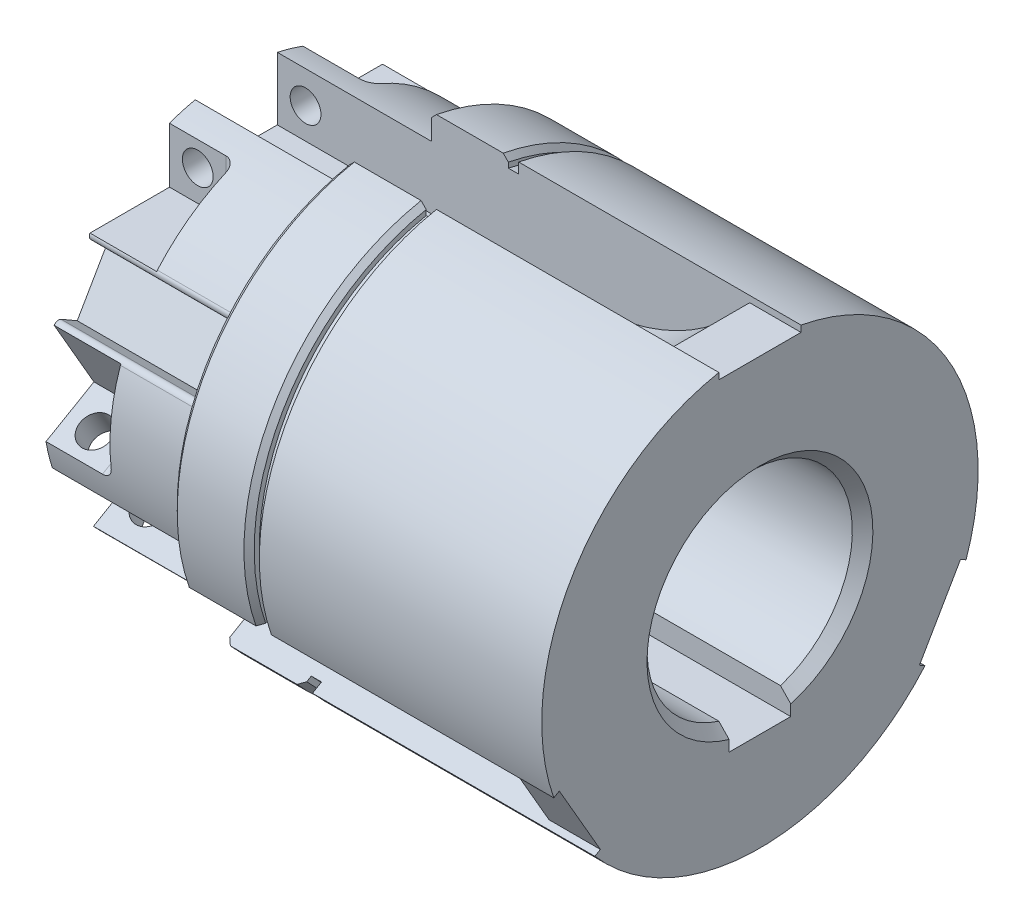
from build123d import *

# Parameters (mm, degrees)
CUT_EXTRUDE1_DEPTH       = 8
CIRPATTERN1_COUNT        = 3
CUT_EXTRUDE2_DEPTH       = 13
FILLET1_R                = 2
CUT_EXTRUDE3_REACH       = 125.655
SKETCH6_R                = 3
CIRPATTERN2_COUNT        = 3
FILLET1_OF_CIRPATTERN2_R = 2
CUT_EXTRUDE4_DEPTH       = 30
FILLET2_R                = 1
CIRPATTERN3_COUNT        = 3
FILLET2_OF_CIRPATTERN3_R = 1
CUT_EXTRUDE5_REACH       = 130.22
SKETCH9_W                = 102
SKETCH9_H                = 12
CHAMFER2_SIZE            = 2
CHAMFER3_SIZE            = 1


with BuildPart() as part:
    # Sketch1 → Revolve1 (revolve)
    with BuildSketch(Plane.XY, mode=Mode.PRIVATE) as revolve1_sk:
        Polygon((0, 20), (0, 42.5), (-55, 42.5), (-55, 40.5), (-57, 40.5), (-57, 42.5), (-72, 42.5), (-72, 37.6), (-102, 37.6), (-102, 20), align=None)
    revolve(revolve1_sk.sketch.rotate(Axis((-534.701035213, 0, 0), (1, 0, 0)), 90), axis=Axis((-534.701035213, 0, 0), (1, 0, 0)))

    # Sketch3 → Cut-Extrude1 (cut, symmetric)
    with BuildSketch(Plane.XY):
        with BuildLine():
            Line((-102, 24.5), (-42, 24.5))
            ThreePointArc((-42, 24.5), (-24.11145618, 28.72291236), (-10, 40.5))
            Line((-10, 40.5), (0, 40.5))
            Line((0, 40.5), (0, 42.5))
            Line((0, 42.5), (-55, 42.5))
            Line((-55, 42.5), (-55, 40.5))
            Line((-55, 40.5), (-57, 40.5))
            Line((-57, 40.5), (-57, 42.5))
            Line((-57, 42.5), (-72, 42.5))
            Line((-72, 42.5), (-72, 37.6))
            Line((-72, 37.6), (-102, 37.6))
            Line((-102, 37.6), (-102, 24.5))
        make_face()
    cut_extrude1 = extrude(amount=CUT_EXTRUDE1_DEPTH, both=True, mode=Mode.SUBTRACT)

    # CirPattern1: Cut-Extrude1 ×3 about axis
    cirpattern1_axis = Axis((0, 0, 0), (1, 0, 0))
    for i in range(1, CIRPATTERN1_COUNT):
        add(cut_extrude1.rotate(cirpattern1_axis, i * 360 / CIRPATTERN1_COUNT), mode=Mode.SUBTRACT)

    # Sketch4 → Cut-Extrude2 (cut)
    with BuildSketch(Plane.ZY.offset(102)):
        with BuildLine():
            Line((-13, 35.281156444), (-13, 24.5))
            Line((-13, 24.5), (-28.522096697, 24.5))
            ThreePointArc((-28.522096697, 24.5), (-21.449462979, 30.881718506), (-13, 35.281156444))
        make_face()
        with BuildLine():
            Line((13, 35.281156444), (13, 24.5))
            Line((13, 24.5), (28.522096697, 24.5))
            ThreePointArc((28.522096697, 24.5), (21.449462979, 30.881718506), (13, 35.281156444))
        make_face()
    cut_extrude2 = extrude(amount=-CUT_EXTRUDE2_DEPTH, mode=Mode.SUBTRACT)

    # Fillet1
    fillet1_edges = [part.edges().sort_by_distance(p)[0] for p in [
        (-89, 29.890578222, -13),
        (-89, 29.890578222, 13),
    ]]
    fillet(fillet1_edges, radius=FILLET1_R)

    # Cut-Extrude3: up to this face of the body (flat: up to its plane)
    cut_extrude3_end = Plane(part.part.faces().sort_by_distance((-96.5, 29.890578222, -13))[0])
    # Sketch6 → Cut-Extrude3 (cut, up to the picked face)
    with BuildSketch(Plane.XY.offset(13), mode=Mode.PRIVATE) as cut_extrude3_sk1:
        with Locations((-96.5, 30.5)):
            Circle(SKETCH6_R)
    cut_extrude3_tool1 = split(extrude(cut_extrude3_sk1.sketch, amount=-CUT_EXTRUDE3_REACH, mode=Mode.PRIVATE), bisect_by=cut_extrude3_end, keep=Keep.BOTH, mode=Mode.PRIVATE)
    cut_extrude3 = cut_extrude3_tool1.solids().sort_by(Axis((-96.5, 30.5, 13), (0, 0, -1)))[0]
    add(cut_extrude3, mode=Mode.SUBTRACT)

    # CirPattern2: Cut-Extrude2, Cut-Extrude3 ×3 about axis
    cirpattern2_axis = Axis((0, 0, 0), (1, 0, 0))
    add([cut_extrude2.rotate(cirpattern2_axis, i * 360 / CIRPATTERN2_COUNT) for i in range(1, CIRPATTERN2_COUNT)], mode=Mode.SUBTRACT)
    add([cut_extrude3.rotate(cirpattern2_axis, i * 360 / CIRPATTERN2_COUNT) for i in range(1, CIRPATTERN2_COUNT)], mode=Mode.SUBTRACT)

    # Fillet1 of CirPattern2
    fillet1_of_cirpattern2_edges = [part.edges().sort_by_distance(p)[0] for p in [
        (-89, -3.686958862, 32.386000074),
        (-89, -26.20361936, 19.386000074),
        (-89, -26.20361936, -19.386000074),
        (-89, -3.686958862, -32.386000074),
    ]]
    fillet(fillet1_of_cirpattern2_edges, radius=FILLET1_OF_CIRPATTERN2_R)

    # Sketch7 → Cut-Extrude4 (cut)
    with BuildSketch(Plane.ZY.offset(102)):
        with BuildLine():
            Line((-6, -37.118189611), (-6, -32.3))
            Line((-6, -32.3), (6, -32.3))
            Line((6, -32.3), (6, -37.118189611))
            ThreePointArc((6, -37.118189611), (0, -37.6), (-6, -37.118189611))
        make_face()
    cut_extrude4 = extrude(amount=-CUT_EXTRUDE4_DEPTH, mode=Mode.SUBTRACT)

    # Fillet2
    fillet2_edges = [part.edges().sort_by_distance(p)[0] for p in [
        (-87, -37.118189611, 6),
        (-87, -37.118189611, -6),
    ]]
    fillet(fillet2_edges, radius=FILLET2_R)

    # CirPattern3: Cut-Extrude4 ×3 about axis
    cirpattern3_axis = Axis((0, 0, 0), (1, 0, 0))
    for i in range(1, CIRPATTERN3_COUNT):
        add(cut_extrude4.rotate(cirpattern3_axis, i * 360 / CIRPATTERN3_COUNT), mode=Mode.SUBTRACT)

    # Fillet2 of CirPattern3
    fillet2_of_cirpattern3_edges = [part.edges().sort_by_distance(p)[0] for p in [
        (-87, 13.362942383, -35.145295146),
        (-87, 23.755247228, -29.145295146),
        (-87, 23.755247228, 29.145295146),
        (-87, 13.362942383, 35.145295146),
    ]]
    fillet(fillet2_of_cirpattern3_edges, radius=FILLET2_OF_CIRPATTERN3_R)

    # Sketch9 → Cut-Extrude5 (cut, up to next)
    with BuildSketch(Plane(origin=(0, -23.3, 0), x_dir=(1, 0, 0), z_dir=(0, 1, 0)), mode=Mode.PRIVATE) as cut_extrude5_sk1:
        with Locations((-51, 0)):
            Rectangle(SKETCH9_W, SKETCH9_H)
    cut_extrude5_tool1 = extrude(cut_extrude5_sk1.sketch, amount=CUT_EXTRUDE5_REACH, mode=Mode.PRIVATE) & part.part
    add(cut_extrude5_tool1.solids().sort_by_distance((-51, -23.3, 0))[0], mode=Mode.SUBTRACT)

    # Chamfer2
    chamfer2_edges = [part.edges().sort_by_distance(p)[0] for p in [
        (0, 20, 0),
        (-102, 20, 0),
    ]]
    chamfer(chamfer2_edges, length=CHAMFER2_SIZE)

    # Chamfer3
    chamfer3_edges = [part.edges().sort_by_distance(p)[0] for p in [
        (-72, -42.5, 0),
        (-72, 21.25, 36.806079661),
        (-57, -42.5, 0),
        (-57, 21.25, 36.806079661),
        (-72, 21.25, -36.806079661),
        (-57, 21.25, -36.806079661),
    ]]
    chamfer(chamfer3_edges, length=CHAMFER3_SIZE)


solid = part.part
